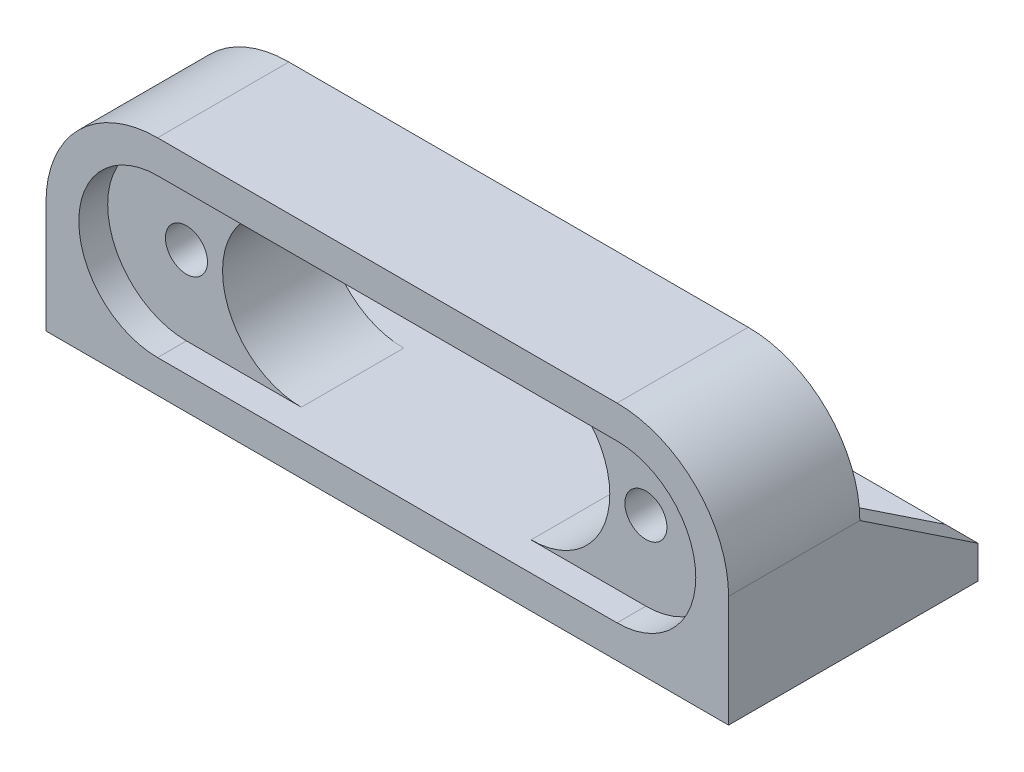
from build123d import *

# Parameters (mm, degrees)
ESBO_O1_R                = 1.6
RESSALTO_EXTRUS_O2_DEPTH = 10
CORTE_EXTRUS_O1_DEPTH    = 2.2
RESSALTO_EXTRUS_O3_DEPTH = 9
ESBO_O4_R                = 1.6
CORTE_EXTRUS_O2_DEPTH    = 9
CORTE_EXTRUS_O3_DEPTH    = 54.630681517


with BuildPart() as part:
    # Esboço1 → Ressalto-extrusão2 (new body)
    with BuildSketch(Plane.XY):
        with BuildLine():
            Line((-26, 0), (-26, -8.5))
            Line((-26, -8.5), (-17.5, -8.5))
            Line((-17.5, -8.5), (0, -8.5))
            Line((0, -8.5), (17.5, -8.5))
            Line((17.5, -8.5), (26, -8.5))
            Line((26, -8.5), (26, 0))
            ThreePointArc((26, 0), (23.51040764, 6.01040764), (17.5, 8.5))
            Line((17.5, 8.5), (0, 8.5))
            Line((0, 8.5), (-17.5, 8.5))
            ThreePointArc((-17.5, 8.5), (-23.51040764, 6.01040764), (-26, 0))
        make_face()
        with Locations((-17.5, 0)):
            Circle(ESBO_O1_R, mode=Mode.SUBTRACT)
        with Locations((17.5, 0)):
            Circle(ESBO_O1_R, mode=Mode.SUBTRACT)
        with BuildLine():
            Line((0, 6), (8.75, 6))
            ThreePointArc((8.75, 6), (14.75, 0), (8.75, -6))
            Line((8.75, -6), (0, -6))
            Line((0, -6), (-8.75, -6))
            ThreePointArc((-8.75, -6), (-14.75, 0), (-8.75, 6))
            Line((-8.75, 6), (0, 6))
        make_face(mode=Mode.SUBTRACT)
    extrude(amount=RESSALTO_EXTRUS_O2_DEPTH)

    # Esboço2 → Corte-extrusão1 (cut)
    with BuildSketch(Plane.XY.offset(10)):
        with BuildLine():
            Line((0, 6), (-17.5, 6))
            ThreePointArc((-17.5, 6), (-23.5, 0), (-17.5, -6))
            Line((-17.5, -6), (0, -6))
            Line((0, -6), (17.5, -6))
            ThreePointArc((17.5, -6), (23.5, 0), (17.5, 6))
            Line((17.5, 6), (0, 6))
        make_face()
    extrude(amount=-CORTE_EXTRUS_O1_DEPTH, mode=Mode.SUBTRACT)

    # Esboço3 → Ressalto-extrusão3 (add)
    with BuildSketch(Plane(origin=(0, 0, 0), x_dir=(-1, 0, 0), z_dir=(0, 0, -1))):
        Polygon((-8.75, -6), (-23.5, -6), (-23.5, 0), (-26, 0), (-26, -8.5), (26, -8.5), (26, 0), (23.5, 0), (23.5, -6), align=None)
    extrude(amount=RESSALTO_EXTRUS_O3_DEPTH)

    # Esboço4 → Corte-extrusão2 (cut)
    with BuildSketch(Plane(origin=(0, -6, 0), x_dir=(1, 0, 0), z_dir=(0, 1, 0))):
        with Locations(Location((-16.55, 4.5, 0), (0, 0, 270))):
            Circle(ESBO_O4_R)
        with Locations(Location((16.55, 4.5, 0), (0, 0, 270))):
            Circle(ESBO_O4_R)
    extrude(amount=-CORTE_EXTRUS_O2_DEPTH, mode=Mode.SUBTRACT)

    # Esboço6 → Corte-extrusão3 (cut, through all)
    with BuildSketch(Plane(origin=(26, 0, 0), x_dir=(0, 0, -1), z_dir=(1, 0, 0))):
        Polygon((9, -6), (0, 0), (2.00580726, 2.470347723), (10.468816684, 1.926634827), (11.248926491, 0), align=None)
    extrude(amount=-CORTE_EXTRUS_O3_DEPTH, mode=Mode.SUBTRACT)


solid = part.part
